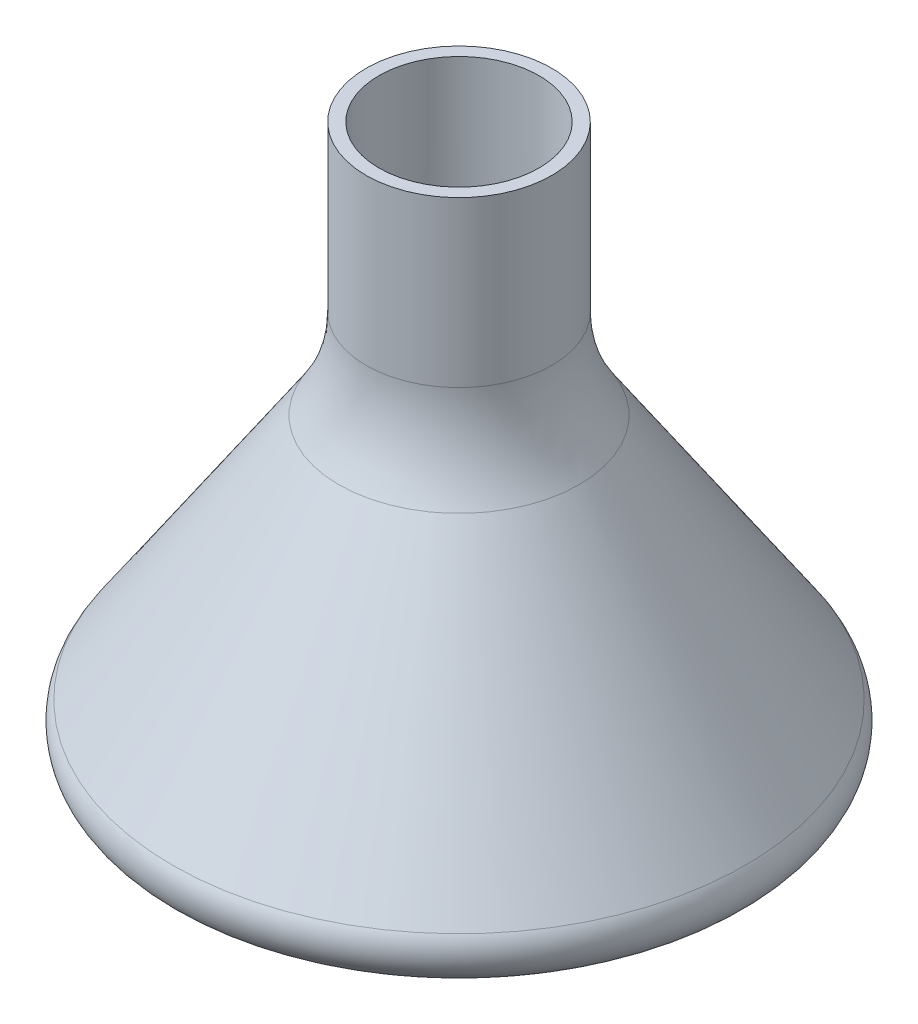
from build123d import *

# Parameters (mm, degrees)
ESQUISSE3_R             = 1.25
ENL_V_MAT_EXTRU_2_DEPTH = 1.2
CONG_1_R                = 15


with BuildPart() as part:
    # Esquisse2 → Révolution1 (revolve)
    with BuildSketch(Plane(origin=(0, 0, 0), x_dir=(0, 0, -1), z_dir=(1, 0, 0)), mode=Mode.PRIVATE) as r_volution1_sk:
        with BuildLine():
            Line((8.7, 31.566988195), (26.843493008, 4.67800089))
            ThreePointArc((26.843493008, 4.67800089), (27.005627419, 1.591810146), (24.356665106, 0))
            Line((24.356665106, 0), (0, 0))
            Line((0, 0), (0, 1.2))
            Line((0, 1.2), (24.356665106, 1.2))
            ThreePointArc((24.356665106, 1.2), (25.946042494, 2.155086088), (25.848761847, 4.006800534))
            Line((25.848761847, 4.006800534), (7.5, 31.2))
            Line((7.5, 31.2), (7.5, 51.566988195))
            Line((7.5, 51.566988195), (8.7, 51.566988195))
            Line((8.7, 51.566988195), (8.7, 31.566988195))
        make_face()
    revolve(r_volution1_sk.sketch.rotate(Axis((0, 1.2, 0), (0, -1, 0)), 180), axis=Axis((0, 1.2, 0), (0, -1, 0)))

    # Esquisse3 → Enlèv. mat.-Extru.2 (cut)
    with BuildSketch(Plane.XZ):
        with Locations(Location((-9.899494937, 0, 0), (0, 0, 270))):
            Circle(ESQUISSE3_R)
        with Locations(Location((-4.949747468, -4.949747468, 0), (0, 0, 270))):
            Circle(ESQUISSE3_R)
        with Locations(Location((0, 0, 0), (0, 0, 270))):
            Circle(ESQUISSE3_R)
        with Locations(Location((4.949747468, 4.949747468, 0), (0, 0, 270))):
            Circle(ESQUISSE3_R)
        with Locations(Location((9.899494937, 19.798989873, 0), (0, 0, 270))):
            Circle(ESQUISSE3_R)
        with Locations(Location((4.949747468, 14.849242405, 0), (0, 0, 270))):
            Circle(ESQUISSE3_R)
        with Locations(Location((14.849242405, 14.849242405, 0), (0, 0, 270))):
            Circle(ESQUISSE3_R)
        with Locations(Location((19.798989873, 9.899494937, 0), (0, 0, 270))):
            Circle(ESQUISSE3_R)
        with Locations(Location((14.849242405, 4.949747468, 0), (0, 0, 270))):
            Circle(ESQUISSE3_R)
        with Locations(Location((19.798989873, 0, 0), (0, 0, 270))):
            Circle(ESQUISSE3_R)
        with Locations(Location((14.849242405, -4.949747468, 0), (0, 0, 270))):
            Circle(ESQUISSE3_R)
        with Locations(Location((-19.798989873, 0, 0), (0, 0, 270))):
            Circle(ESQUISSE3_R)
        with Locations(Location((-14.849242405, 4.949747468, 0), (0, 0, 270))):
            Circle(ESQUISSE3_R)
        with Locations(Location((-19.798989873, 9.899494937, 0), (0, 0, 270))):
            Circle(ESQUISSE3_R)
        with Locations(Location((-14.849242405, 14.849242405, 0), (0, 0, 270))):
            Circle(ESQUISSE3_R)
        with Locations(Location((-9.899494937, 19.798989873, 0), (0, 0, 270))):
            Circle(ESQUISSE3_R)
        with Locations(Location((0, 19.798989873, 0), (0, 0, 270))):
            Circle(ESQUISSE3_R)
        with Locations(Location((-4.949747468, 14.849242405, 0), (0, 0, 270))):
            Circle(ESQUISSE3_R)
        with Locations(Location((-9.899494937, 9.899494937, 0), (0, 0, 270))):
            Circle(ESQUISSE3_R)
        with Locations(Location((-4.949747468, 4.949747468, 0), (0, 0, 270))):
            Circle(ESQUISSE3_R)
        with Locations(Location((0, 9.899494937, 0), (0, 0, 270))):
            Circle(ESQUISSE3_R)
        with Locations(Location((9.899494937, 9.899494937, 0), (0, 0, 270))):
            Circle(ESQUISSE3_R)
        with Locations(Location((9.899494937, 0, 0), (0, 0, 270))):
            Circle(ESQUISSE3_R)
        with Locations(Location((4.949747468, -4.949747468, 0), (0, 0, 270))):
            Circle(ESQUISSE3_R)
        with Locations(Location((0, -9.899494937, 0), (0, 0, 270))):
            Circle(ESQUISSE3_R)
        with Locations(Location((-9.899494937, -9.899494937, 0), (0, 0, 270))):
            Circle(ESQUISSE3_R)
        with Locations(Location((-14.849242405, -4.949747468, 0), (0, 0, 270))):
            Circle(ESQUISSE3_R)
        with Locations(Location((-19.798989873, -9.899494937, 0), (0, 0, 270))):
            Circle(ESQUISSE3_R)
        with Locations(Location((-14.849242405, -14.849242405, 0), (0, 0, 270))):
            Circle(ESQUISSE3_R)
        with Locations(Location((-9.899494937, -19.798989873, 0), (0, 0, 270))):
            Circle(ESQUISSE3_R)
        with Locations(Location((-4.949747468, -14.849242405, 0), (0, 0, 270))):
            Circle(ESQUISSE3_R)
        with Locations(Location((0, -19.798989873, 0), (0, 0, 270))):
            Circle(ESQUISSE3_R)
        with Locations(Location((4.949747468, -14.849242405, 0), (0, 0, 270))):
            Circle(ESQUISSE3_R)
        with Locations(Location((9.899494937, -9.899494937, 0), (0, 0, 270))):
            Circle(ESQUISSE3_R)
        with Locations(Location((9.899494937, -19.798989873, 0), (0, 0, 270))):
            Circle(ESQUISSE3_R)
        with Locations(Location((14.849242405, -14.849242405, 0), (0, 0, 270))):
            Circle(ESQUISSE3_R)
        with Locations(Location((19.798989873, -9.899494937, 0), (0, 0, 270))):
            Circle(ESQUISSE3_R)
    extrude(amount=-ENL_V_MAT_EXTRU_2_DEPTH, mode=Mode.SUBTRACT)

    # Congé1
    cong_1_edges = [part.edges().sort_by_distance(p)[0] for p in [
        (0, 31.566988195, -8.7),
        (0, 31.2, -7.5),
    ]]
    fillet(cong_1_edges, radius=CONG_1_R)


solid = part.part
